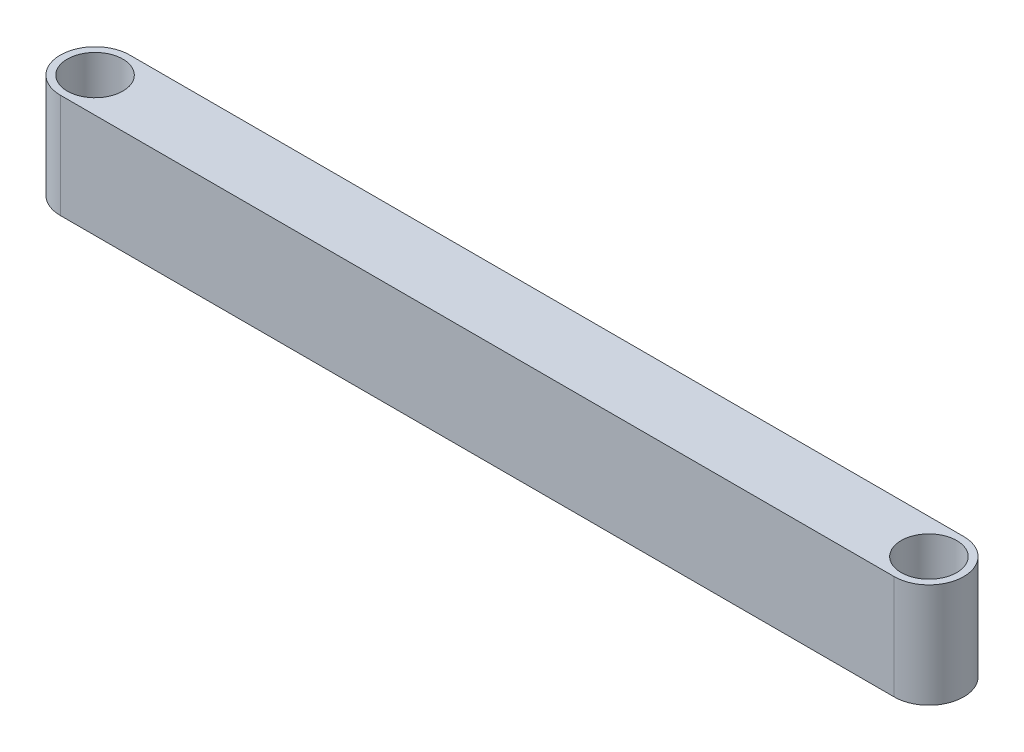
from build123d import *

# Parameters (mm, degrees)
SKETCH1_R           = 0.4
BOSS_EXTRUDE1_DEPTH = 1.5


with BuildPart() as part:
    # Sketch1 → Boss-Extrude1 (new body)
    with BuildSketch(Plane(origin=(0, 0, 0), x_dir=(1, 0, 0), z_dir=(0, 1, 0))):
        with BuildLine():
            Line((-56.274372554, 12.217462462), (-44.274372554, 12.217462462))
            ThreePointArc((-44.274372554, 12.217462462), (-43.774372554, 11.717462462), (-44.274372554, 11.217462462))
            Line((-44.274372554, 11.217462462), (-56.274372554, 11.217462462))
            ThreePointArc((-56.274372554, 11.217462462), (-56.774372554, 11.717462462), (-56.274372554, 12.217462462))
        make_face()
        with Locations(Location((-56.274372554, 11.717462462, 0), (0, 0, 270))):
            Circle(SKETCH1_R, mode=Mode.SUBTRACT)
        with Locations(Location((-44.274372554, 11.717462462, 0), (0, 0, 270))):
            Circle(SKETCH1_R, mode=Mode.SUBTRACT)
    extrude(amount=BOSS_EXTRUDE1_DEPTH)


solid = part.part
